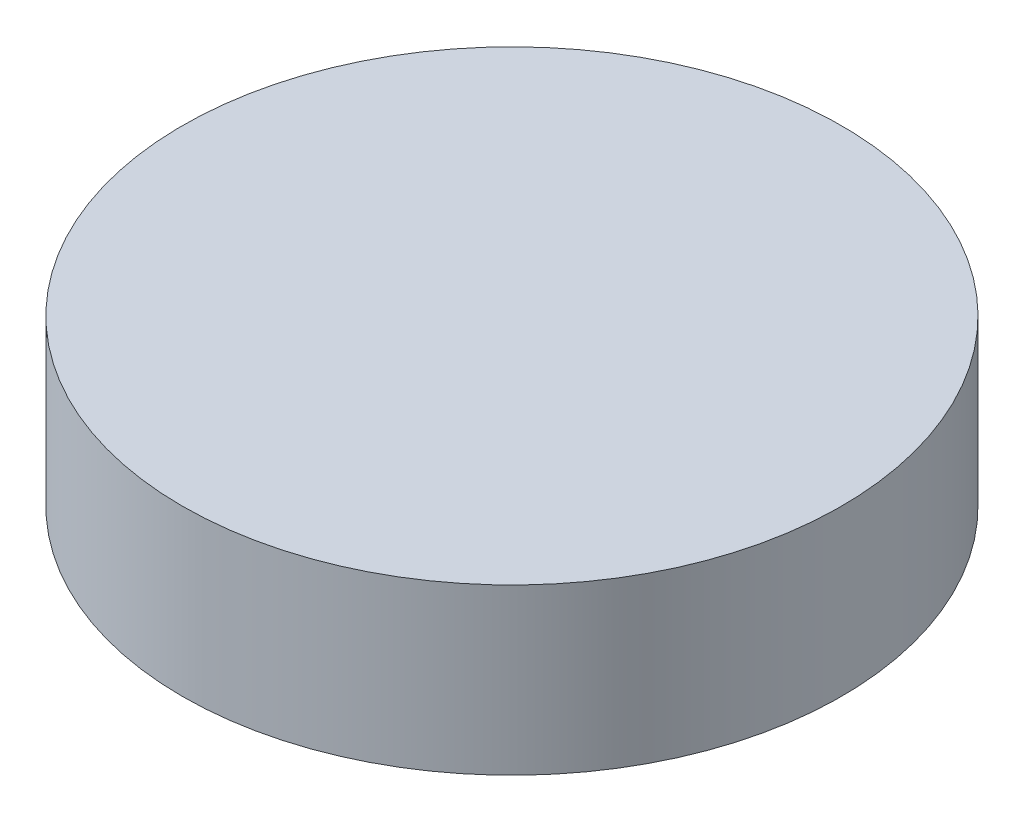
from build123d import *

# Parameters (mm, degrees)
BOSS_EXTRUDE1_DEPTH      = 2.54
BOSS_EXTRUDE1_DEPTH_BACK = 2.54
SKETCH4_R                = 10.16


with BuildPart() as part:
    # Sketch4 → Boss-Extrude1 (new, two sides: drawn at the far end of the back side and taken through both)
    with BuildSketch(Plane(origin=(0, 0, 0), x_dir=(1, 0, 0), z_dir=(0, 1, 0)).offset(-BOSS_EXTRUDE1_DEPTH_BACK)):
        Circle(SKETCH4_R)
    extrude(amount=BOSS_EXTRUDE1_DEPTH + BOSS_EXTRUDE1_DEPTH_BACK)


solid = part.part
